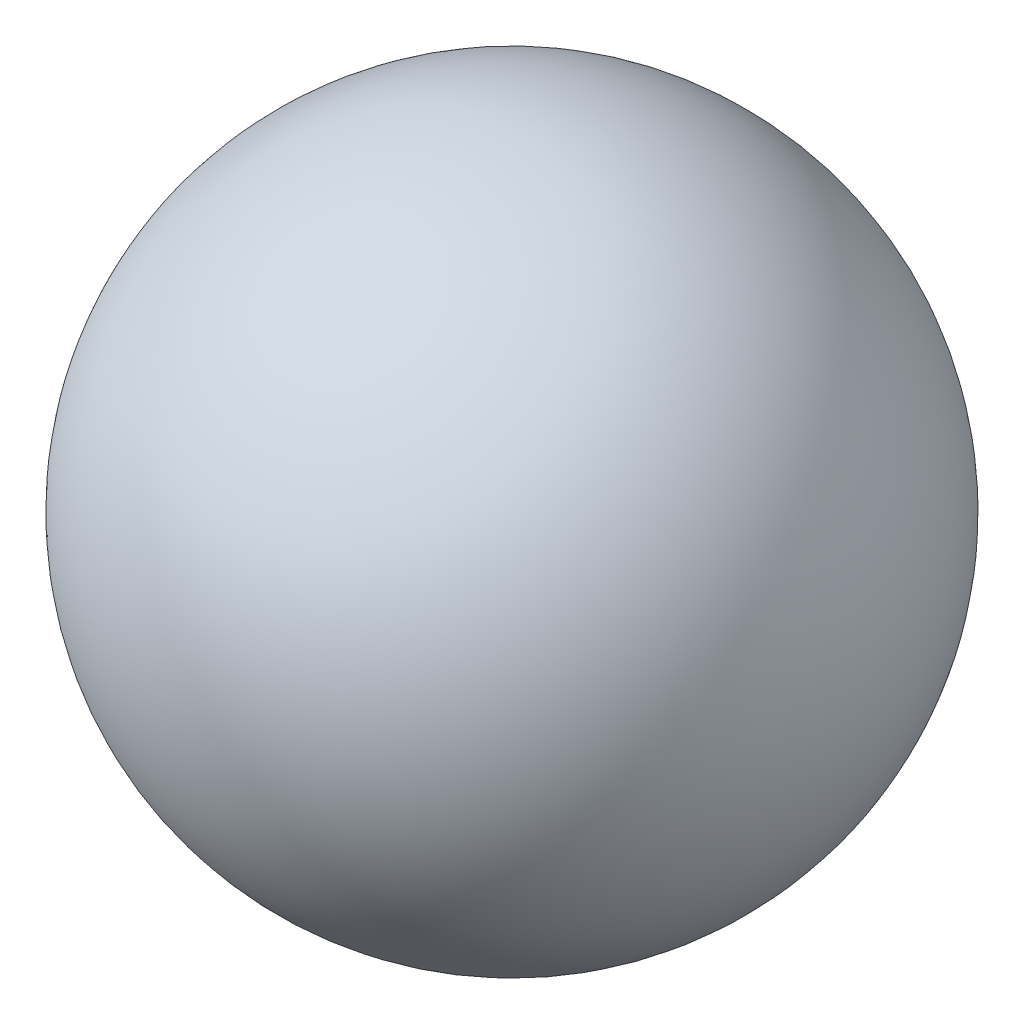
from build123d import *


with BuildPart() as part:
    # Sketch1 → Revolve1 (revolve)
    with BuildSketch(Plane.XY):
        with BuildLine():
            Line((0, 0), (24, 0))
            ThreePointArc((24, 0), (12, -12), (0, 0))
        make_face()
    revolve(axis=Axis((0, 0, 0), (1, 0, 0)))


solid = part.part
